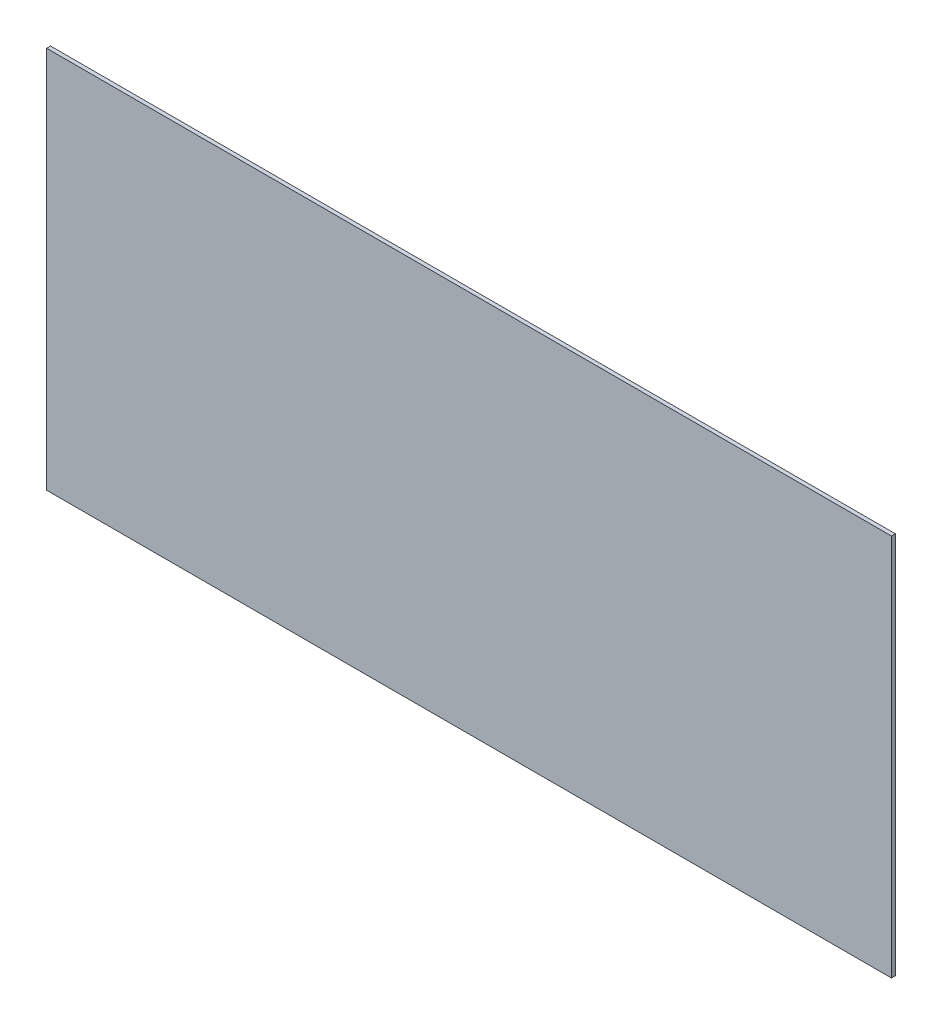
from build123d import *

# Parameters (mm, degrees)
SKETCH1_W           = 345.52
SKETCH1_H           = 156.55
BOSS_EXTRUDE1_DEPTH = 1.5875


with BuildPart() as part:
    # Sketch1 → Boss-Extrude1 (new body)
    with BuildSketch(Plane.XY):
        Rectangle(SKETCH1_W, SKETCH1_H)
    extrude(amount=BOSS_EXTRUDE1_DEPTH)


solid = part.part
